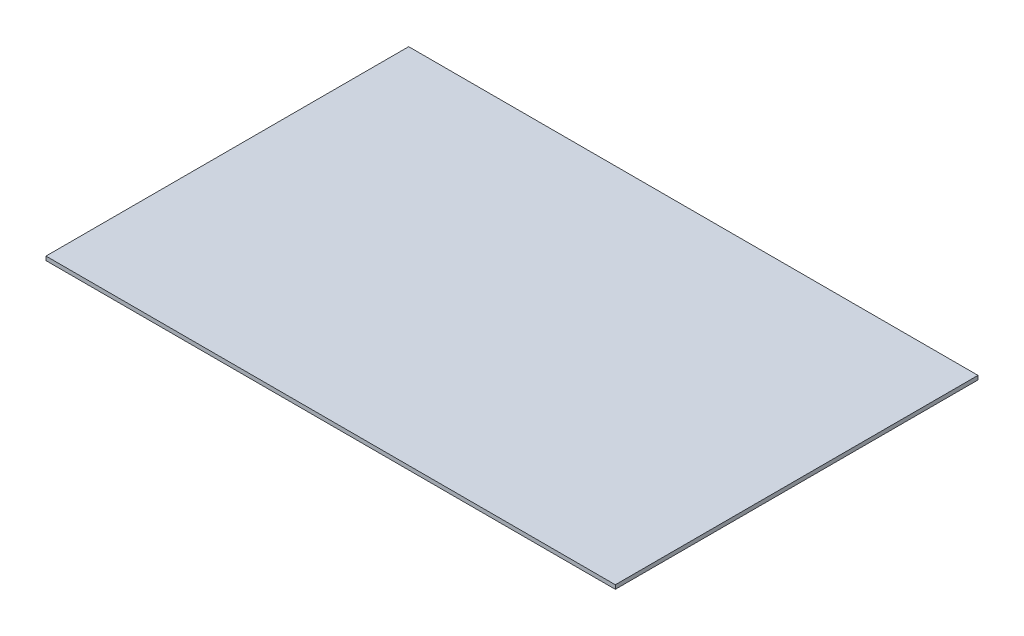
from build123d import *

# Parameters (mm, degrees)
SCHIZZO1_W                   = 2857
SCHIZZO1_H                   = 1820
ESTRUSIONE_ESTRUSIONE1_DEPTH = 20


with BuildPart() as part:
    # Schizzo1 → Estrusione-Estrusione1 (new body)
    with BuildSketch(Plane(origin=(0, 0, 0), x_dir=(1, 0, 0), z_dir=(0, 1, 0))):
        Rectangle(SCHIZZO1_W, SCHIZZO1_H)
    extrude(amount=ESTRUSIONE_ESTRUSIONE1_DEPTH)


solid = part.part
